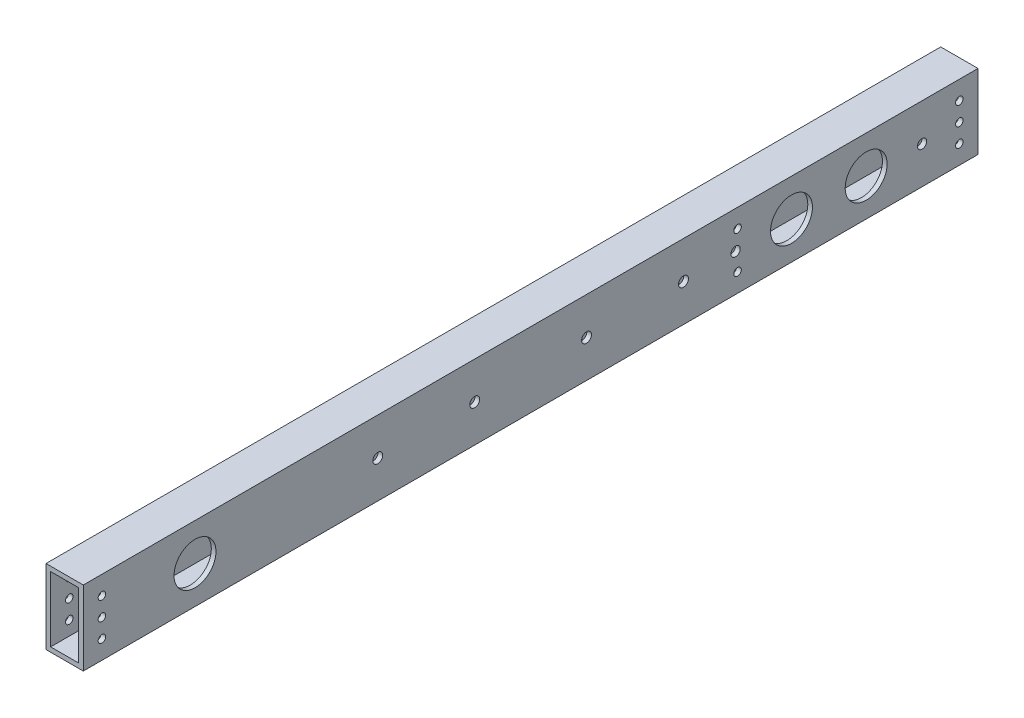
from build123d import *

# Parameters (mm, degrees)
SKETCH1_W               = 25.4
SKETCH1_H               = 50.8
SKETCH1_W_2             = 19.05
SKETCH1_H_2             = 44.45
BOSS_EXTRUDE1_DEPTH     = 304.8
F_10_CLEARANCE_HOLE1_D  = 5.1054
F_1_4_CLEARANCE_HOLE2_D = 6.7564
SKETCH7_R               = 14.2875
SKETCH7_R_2             = 3.175
CUT_EXTRUDE1_DEPTH      = 307.909367729
SKETCH8_R               = 2.5527
CUT_EXTRUDE2_DEPTH      = 307.909367729


with BuildPart() as part:
    # Sketch1 → Boss-Extrude1 (new, symmetric)
    with BuildSketch(Plane.XY):
        Rectangle(SKETCH1_W, SKETCH1_H)
        Rectangle(SKETCH1_W_2, SKETCH1_H_2, mode=Mode.SUBTRACT)
    extrude(amount=BOSS_EXTRUDE1_DEPTH, both=True)

    # #10 Clearance Hole1 (through all)
    with Locations(Plane(origin=(12.7, 0, 0), x_dir=(0, 0, -1), z_dir=(1, 0, 0))):
        with Locations((-292.1, 12.7), (-292.1, 0), (-292.1, -12.7)):
            f_10_clearance_hole1 = Hole(F_10_CLEARANCE_HOLE1_D / 2)

    # Mirror1: #10 Clearance Hole1 across plane
    add(f_10_clearance_hole1.mirror(Plane.XY), mode=Mode.SUBTRACT)

    # 1/4 Clearance Hole2 (through all)
    with Locations(Plane(origin=(12.7, 0, 0), x_dir=(0, 0, -1), z_dir=(1, 0, 0))):
        with Locations((-38.1, 0), (38.1, 0), (-104.14, 0), (104.14, 0)):
            Hole(F_1_4_CLEARANCE_HOLE2_D / 2)

    # Sketch7 → Cut-Extrude1 (cut, through all)
    with BuildSketch(Plane(origin=(12.7, 0, 0), x_dir=(0, 0, -1), z_dir=(1, 0, 0))):
        with Locations(Location((-228.6762, 0, 0), (0, 0, 90))):
            Circle(SKETCH7_R)
        with Locations(Location((177.7238, 0, 0), (0, 0, 90))):
            Circle(SKETCH7_R)
        with Locations(Location((228.6, 0, 0), (0, 0, 90))):
            Circle(SKETCH7_R)
        with Locations(Location((139.6238, 0, 0), (0, 0, 90))):
            Circle(SKETCH7_R_2)
        with Locations(Location((266.7, 0, 0), (0, 0, 90))):
            Circle(SKETCH7_R_2)
    extrude(amount=-CUT_EXTRUDE1_DEPTH, mode=Mode.SUBTRACT)

    # Sketch8 → Cut-Extrude2 (cut, through all)
    with BuildSketch(Plane(origin=(12.7, 0, 0), x_dir=(0, 0, -1), z_dir=(1, 0, 0))):
        with Locations(Location((140.97, 12.7, 0), (0, 0, 90))):
            Circle(SKETCH8_R)
        with Locations(Location((140.97, -12.7, 0), (0, 0, 90))):
            Circle(SKETCH8_R)
    extrude(amount=-CUT_EXTRUDE2_DEPTH, mode=Mode.SUBTRACT)


solid = part.part
